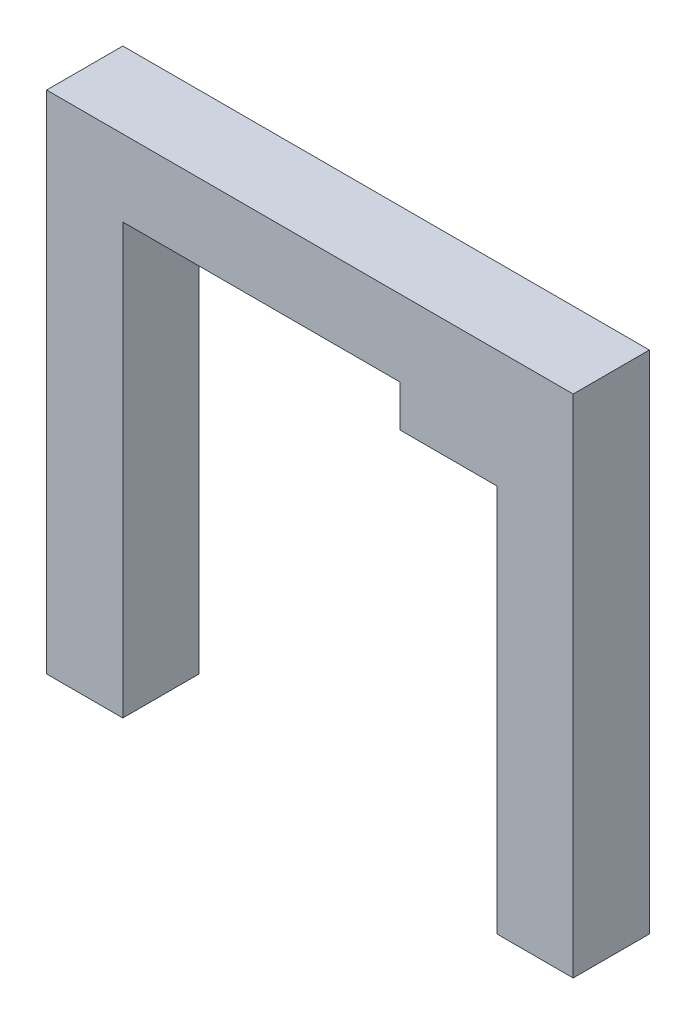
from build123d import *

# Parameters (mm, degrees)
EXTRUDE_1_DEPTH = 5.5


with BuildPart() as part:
    # ｽｹｯﾁ1 → ﾎﾞｽ - 押し出し1 (new body)
    with BuildSketch(Plane.XY):
        Polygon((0, 0), (0, 31), (20, 31), (20, 28), (27, 28), (27, 0), (32.5, 0), (32.5, 36.5), (-5.5, 36.5), (-5.5, 0), align=None)
    extrude(amount=EXTRUDE_1_DEPTH)


solid = part.part
